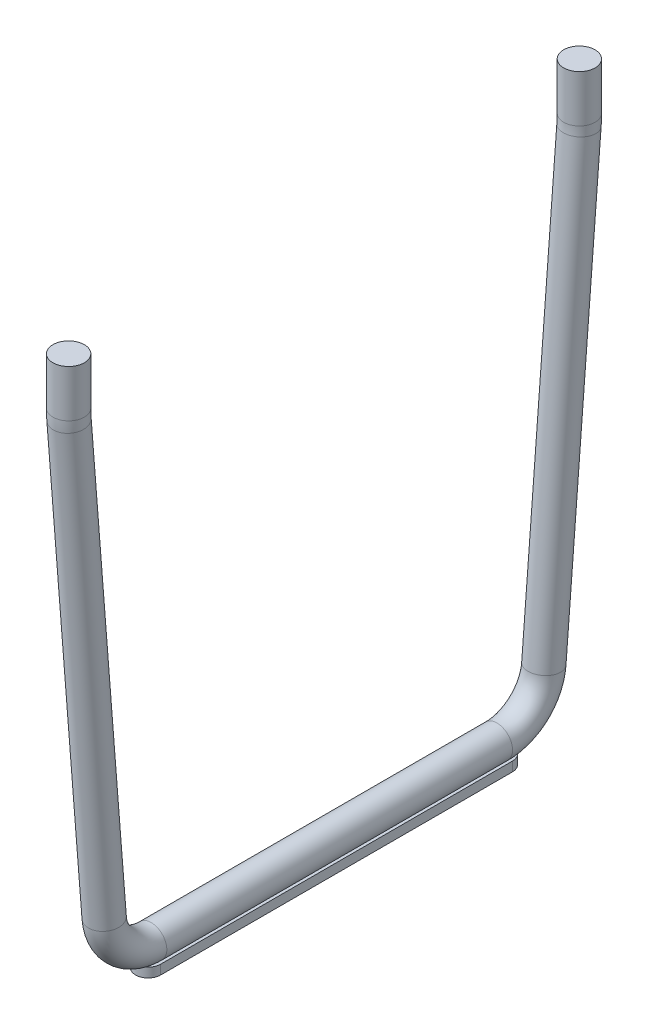
from build123d import *

# Parameters (mm, degrees)
SKETCH4_R                = 5
BOSS_EXTRUDE2_DEPTH      = 56
BOSS_EXTRUDE2_DEPTH_BACK = 56
SKETCH5_W                = 8
SKETCH5_H                = 3
SKETCH6_W                = 4
SKETCH6_H                = 3
REVOLVE1_ANGLE           = 180


with BuildPart() as part:
    # Sweep7: sweep along a path in Sketch2
    with BuildLine(Plane(origin=(-81.317279836, 0, 0), x_dir=(0, 0, -1), z_dir=(1, 0, 0))) as sweep7_path:
        Line((0, -175), (-55.045760302, -175))
        ThreePointArc((-55.045760302, -175), (-65.230021906, -171.012756947), (-70, -161.170775411))
        Line((-70, -161.170775411), (-81.191157553, -18.226833323))
        ThreePointArc((-81.191157553, -18.226833323), (-81.285737233, -16.614648578), (-81.317279836, -15))
        Line((-81.317279836, -15), (-81.317279836, 0))
    # Sketch4 → Sweep7 (sweep)
    with BuildSketch(Plane.XY):
        with Locations((-81.317279836, -175)):
            Circle(SKETCH4_R)
    sweep7 = sweep(path=sweep7_path.line)

    # Mirror2: Sweep7 across plane
    add(sweep7.mirror(Plane.XY))

    # Sketch5 → Boss-Extrude2 (add, two sides: drawn at the far end of the back side and taken through both)
    with BuildSketch(Plane.XY.offset(-BOSS_EXTRUDE2_DEPTH_BACK)):
        with Locations((-81.317279836, -180.5)):
            Rectangle(SKETCH5_W, SKETCH5_H)
    extrude(amount=BOSS_EXTRUDE2_DEPTH + BOSS_EXTRUDE2_DEPTH_BACK)

    # Sketch6 → Revolve1 (revolve)
    with BuildSketch(Plane.XY.offset(56)):
        with Locations((-79.317279836, -180.5)):
            Rectangle(SKETCH6_W, SKETCH6_H)
    revolve1 = revolve(axis=Axis((-81.317279836, -182, 56), (0, -1, 0)), revolution_arc=REVOLVE1_ANGLE)

    # Mirror3: Revolve1 across plane
    add(revolve1.mirror(Plane.XY))


solid = part.part
